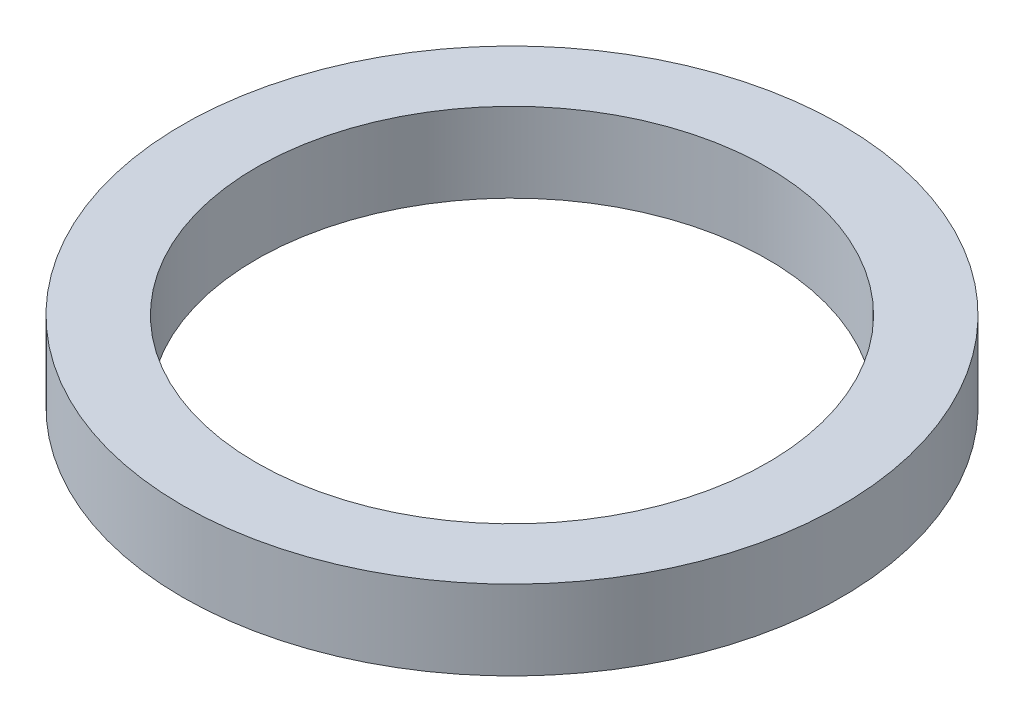
from build123d import *

# Parameters (mm, degrees)
SKETCH_1_R      = 29
SKETCH_1_R_2    = 22.5
EXTRUDE_1_DEPTH = 7


with BuildPart() as part:
    # 草图1 → 凸台-拉伸1 (new body)
    with BuildSketch(Plane(origin=(0, 0, 0), x_dir=(1, 0, 0), z_dir=(0, 1, 0))):
        with Locations(Location((0, 0, 0), (0, 0, 270))):
            Circle(SKETCH_1_R)
        with Locations(Location((0, 0, 0), (0, 0, 270))):
            Circle(SKETCH_1_R_2, mode=Mode.SUBTRACT)
    extrude(amount=EXTRUDE_1_DEPTH)


solid = part.part
